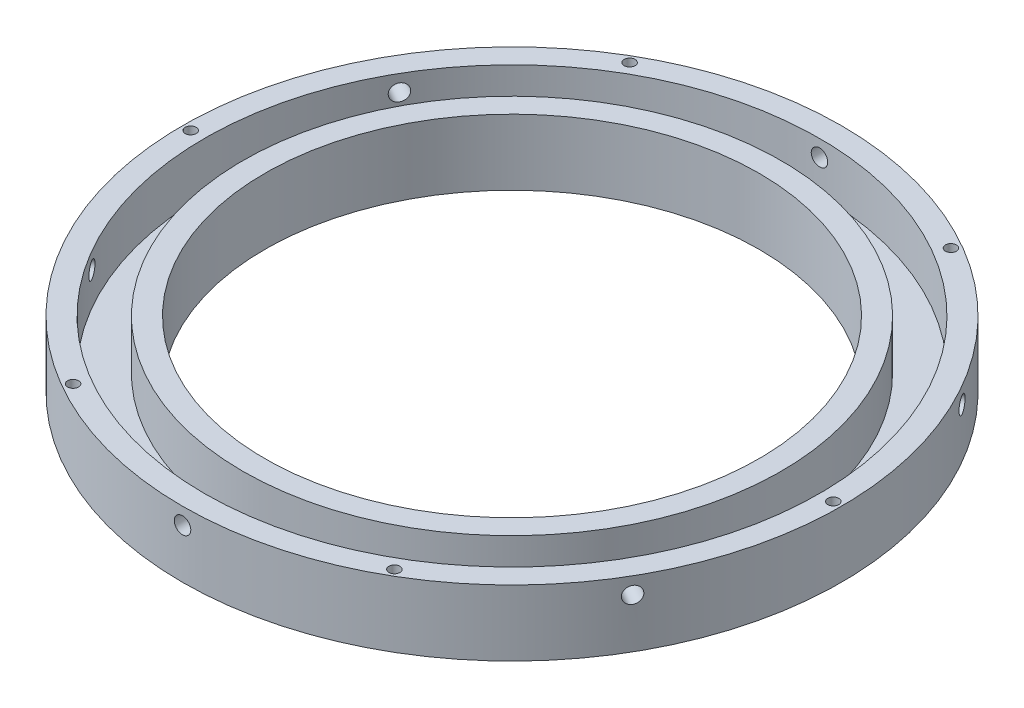
from build123d import *

# Parameters (mm, degrees)
SKETCH1_R               = 76.2
SKETCH1_R_2             = 57.15
BOSS_EXTRUDE1_DEPTH     = 15.24
SKETCH2_R               = 71.12
SKETCH2_R_2             = 62.23
CUT_EXTRUDE1_DEPTH      = 11.43
CUT_EXTRUDE2_REACH      = 110.835
SKETCH3_R               = 4.318
SKETCH4_R               = 6.858
CUT_EXTRUDE3_DEPTH      = 1.27
CUT_EXTRUDE4_REACH      = 173.069
CUT_EXTRUDE4_END_RADIUS = 71.12
SKETCH5_R               = 1.905
CIRPATTERN1_COUNT       = 6
SKETCH6_R               = 1.27
CUT_EXTRUDE5_DEPTH      = 2.54


with BuildPart() as part:
    # Sketch1 → Boss-Extrude1 (new body)
    with BuildSketch(Plane(origin=(0, 0, 0), x_dir=(1, 0, 0), z_dir=(0, 1, 0))):
        with Locations(Location((0, 0, 0), (0, 0, 90))):
            Circle(SKETCH1_R)
        with Locations(Location((0, 0, 0), (0, 0, 90))):
            Circle(SKETCH1_R_2, mode=Mode.SUBTRACT)
    extrude(amount=BOSS_EXTRUDE1_DEPTH)

    # Sketch2 → Cut-Extrude1 (cut)
    with BuildSketch(Plane(origin=(0, 15.24, 0), x_dir=(1, 0, 0), z_dir=(0, 1, 0))):
        with Locations(Location((0, 0, 0), (0, 0, 270))):
            Circle(SKETCH2_R)
        with Locations(Location((0, 0, 0), (0, 0, 270))):
            Circle(SKETCH2_R_2, mode=Mode.SUBTRACT)
    extrude(amount=-CUT_EXTRUDE1_DEPTH, mode=Mode.SUBTRACT)

    # Sketch3 → Cut-Extrude2 (cut, up to next)
    with BuildSketch(Plane.XZ, mode=Mode.PRIVATE) as cut_extrude2_sk1:
        with Locations(Location((-66.675, 0, 0), (0, 0, 270))):
            Circle(SKETCH3_R)
    cut_extrude2_tool1 = extrude(cut_extrude2_sk1.sketch, amount=-CUT_EXTRUDE2_REACH, mode=Mode.PRIVATE) & part.part
    # Sketch3 → Cut-Extrude2 (cut, up to next)
    with BuildSketch(Plane.XZ, mode=Mode.PRIVATE) as cut_extrude2_sk2:
        with Locations(Location((66.675, 0, 0), (0, 0, 270))):
            Circle(SKETCH3_R)
    cut_extrude2_tool2 = extrude(cut_extrude2_sk2.sketch, amount=-CUT_EXTRUDE2_REACH, mode=Mode.PRIVATE) & part.part
    add(cut_extrude2_tool1.solids().sort_by_distance((-66.675, 0, 0))[0], mode=Mode.SUBTRACT)
    add(cut_extrude2_tool2.solids().sort_by_distance((66.675, 0, 0))[0], mode=Mode.SUBTRACT)

    # Sketch4 → Cut-Extrude3 (cut)
    with BuildSketch(Plane.XZ):
        with Locations(Location((-66.675, 0, 0), (0, 0, 270))):
            Circle(SKETCH4_R)
        with Locations(Location((66.675, 0, 0), (0, 0, 270))):
            Circle(SKETCH4_R)
    extrude(amount=-CUT_EXTRUDE3_DEPTH, mode=Mode.SUBTRACT)

    # Cut-Extrude4: up to this cylinder (the profile starts outside it)
    cut_extrude4_end = Plane(origin=(0, 11.43, 0), z_dir=(0, 1, 0)) * Cylinder(CUT_EXTRUDE4_END_RADIUS, 489.378, mode=Mode.PRIVATE)
    # Sketch5 → Cut-Extrude4 (cut, up to the surface)
    with BuildSketch(Plane.XY.offset(76.2), mode=Mode.PRIVATE) as cut_extrude4_sk1:
        with Locations((0, 11.43)):
            Circle(SKETCH5_R)
    cut_extrude4_tool1 = extrude(cut_extrude4_sk1.sketch, amount=-CUT_EXTRUDE4_REACH, mode=Mode.PRIVATE) - cut_extrude4_end
    cut_extrude4 = cut_extrude4_tool1.solids().sort_by_distance((0, 11.43, 76.2))[0]
    add(cut_extrude4, mode=Mode.SUBTRACT)

    # CirPattern1: Cut-Extrude4 ×6 about axis
    cirpattern1_axis = Axis((0, 15.24, 0), (0, -1, 0))
    for i in range(1, CIRPATTERN1_COUNT):
        add(cut_extrude4.rotate(cirpattern1_axis, i * 360 / CIRPATTERN1_COUNT), mode=Mode.SUBTRACT)

    # Sketch6 → Cut-Extrude5 (cut)
    with BuildSketch(Plane(origin=(0, 15.24, 0), x_dir=(1, 0, 0), z_dir=(0, 1, 0))):
        with Locations(Location((37.1475, 64.341357374, 0), (0, 0, 270))):
            Circle(SKETCH6_R)
        with Locations(Location((74.295, 0, 0), (0, 0, 270))):
            Circle(SKETCH6_R)
        with Locations(Location((37.1475, -64.341357374, 0), (0, 0, 270))):
            Circle(SKETCH6_R)
        with Locations(Location((-37.1475, -64.341357374, 0), (0, 0, 270))):
            Circle(SKETCH6_R)
        with Locations(Location((-74.295, 0, 0), (0, 0, 270))):
            Circle(SKETCH6_R)
        with Locations(Location((-37.1475, 64.341357374, 0), (0, 0, 270))):
            Circle(SKETCH6_R)
    extrude(amount=-CUT_EXTRUDE5_DEPTH, mode=Mode.SUBTRACT)


solid = part.part
